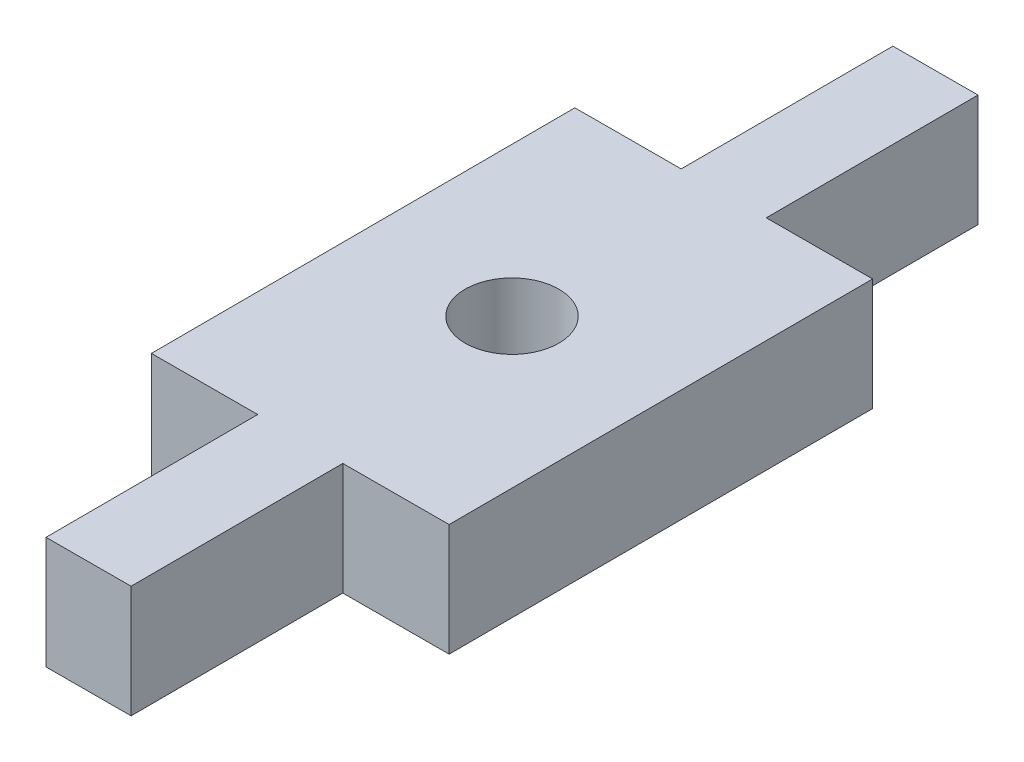
from build123d import *

# Parameters (mm, degrees)
SKETCH1_R           = 1.324874029
BOSS_EXTRUDE1_DEPTH = 3.175


with BuildPart() as part:
    # Sketch1 → Boss-Extrude1 (new body)
    with BuildSketch(Plane(origin=(0, 0, 0), x_dir=(1, 0, 0), z_dir=(0, 1, 0))):
        Polygon((95.427674187, 114.606816956), (95.441360448, 108.606897975), (97.841360448, 108.612297975), (97.827760687, 114.612192549), (100.827653149, 114.619017134), (100.800652767, 126.618986762), (97.800760752, 126.612162178), (97.787360584, 132.612237226), (95.387360584, 132.606837226), (95.400774253, 126.606786816), (92.400673805, 126.600186595), (92.427674187, 114.600216956), align=None)
        with Locations(Location((96.614163555, 120.609567157, 0), (0, 0, 270))):
            Circle(SKETCH1_R, mode=Mode.SUBTRACT)
    extrude(amount=BOSS_EXTRUDE1_DEPTH)


solid = part.part
